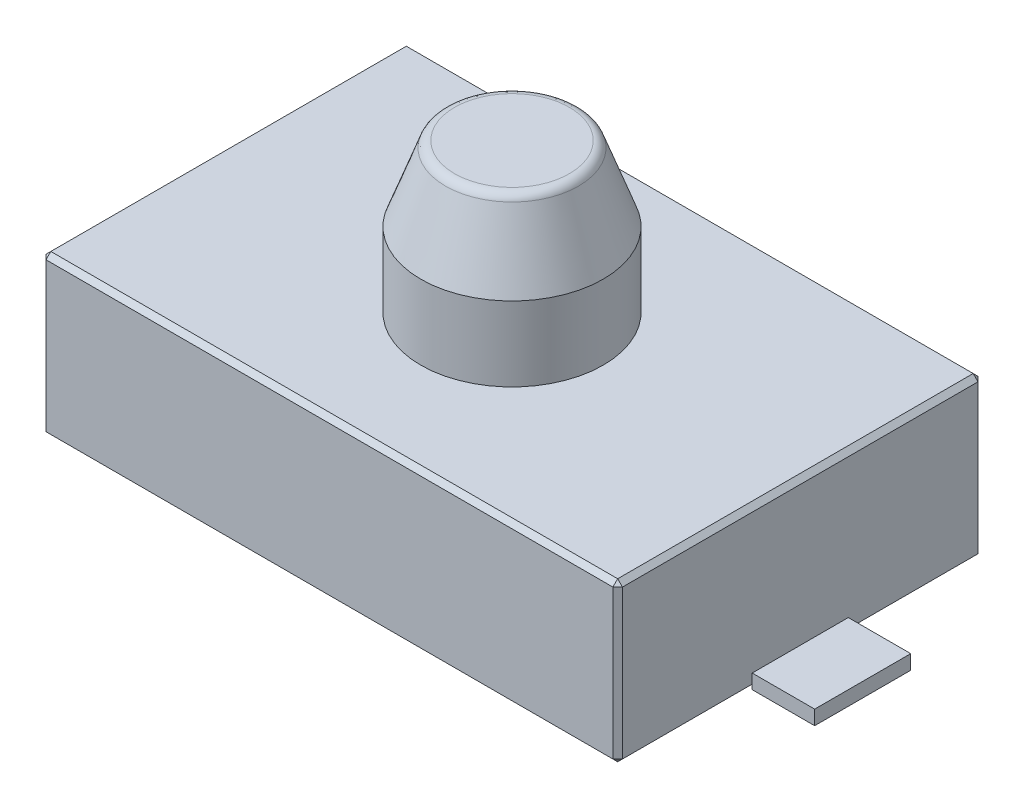
from build123d import *

# Parameters (mm, degrees)
SKETCH1_W             = 6
SKETCH1_H             = 3.8
BOSS_EXTRUDE1_DEPTH   = 1.65
SKETCH1_3_W           = 0.65
SKETCH1_3_H           = 1
BOSS_EXTRUDE2_DEPTH   = 0.15
BOSS_EXTRUDE2_2_DEPTH = 0.15
SKETCH2_R             = 0.95
BOSS_EXTRUDE3_DEPTH   = 0.775
SKETCH4_R             = 0.95
BOSS_EXTRUDE4_DEPTH   = 0.775
BOSS_EXTRUDE4_TAPER   = 20
FILLET1_R             = 0.1
CHAMFER1_SIZE         = 0.05


with BuildPart() as part:
    # Sketch1 → Boss-Extrude1 (new body)
    with BuildSketch(Plane(origin=(0, 0, 0), x_dir=(1, 0, 0), z_dir=(0, 1, 0))):
        with Locations((-1.549940831, -1.675974026)):
            Rectangle(SKETCH1_W, SKETCH1_H)
    extrude(amount=BOSS_EXTRUDE1_DEPTH)

    # Chamfer1
    chamfer1_edges = [part.edges().sort_by_distance(p)[0] for p in [
        (1.450059169, 0, 1.675974026),
        (-4.549940831, 0, 1.675974026),
        (1.450059169, 0.825, -0.224025974),
        (-1.549940831, 0, -0.224025974),
        (-4.549940831, 0.825, -0.224025974),
        (-4.549940831, 0.825, 3.575974026),
        (-1.549940831, 0, 3.575974026),
        (1.450059169, 0.825, 3.575974026),
        (-1.549940831, 1.65, -0.224025974),
        (1.450059169, 1.65, 1.675974026),
        (-1.549940831, 1.65, 3.575974026),
        (-4.549940831, 1.65, 1.675974026),
    ]]
    chamfer(chamfer1_edges, length=CHAMFER1_SIZE)


with BuildPart() as body_2:
    # Sketch1<3> → Boss-Extrude2 (new body)
    with BuildSketch(Plane(origin=(0, 0, 0), x_dir=(1, 0, 0), z_dir=(0, 1, 0))):
        with Locations((1.775059169, -1.675974026)):
            Rectangle(SKETCH1_3_W, SKETCH1_3_H)
    extrude(amount=BOSS_EXTRUDE2_DEPTH)


with BuildPart() as body_3:
    # Sketch1<3> → Boss-Extrude2 2 (new body)
    with BuildSketch(Plane(origin=(0, 0, 0), x_dir=(1, 0, 0), z_dir=(0, 1, 0))):
        with Locations((-4.874940831, -1.675974026)):
            Rectangle(SKETCH1_3_W, SKETCH1_3_H)
    extrude(amount=BOSS_EXTRUDE2_2_DEPTH)


with BuildPart() as body_4:
    # Sketch2 → Boss-Extrude3 (new body)
    with BuildSketch(Plane(origin=(0, 1.65, 0), x_dir=(1, 0, 0), z_dir=(0, 1, 0))):
        with Locations((-1.549940831, -1.675974026)):
            Circle(SKETCH2_R)
    extrude(amount=BOSS_EXTRUDE3_DEPTH)

    # Sketch4 → Boss-Extrude4 (add)
    with BuildSketch(Plane(origin=(0, 2.425, 0), x_dir=(1, 0, 0), z_dir=(0, 1, 0))):
        with Locations((-1.549940831, -1.675974026)):
            Circle(SKETCH4_R)
    extrude(amount=BOSS_EXTRUDE4_DEPTH, taper=BOSS_EXTRUDE4_TAPER)

    # Fillet1
    fillet1_edges = [body_4.edges().sort_by_distance(p)[0] for p in [
        (-2.2178639, 3.2, 1.675974026),
    ]]
    fillet(fillet1_edges, radius=FILLET1_R)


solid = Compound([part.part, body_2.part, body_3.part, body_4.part])
